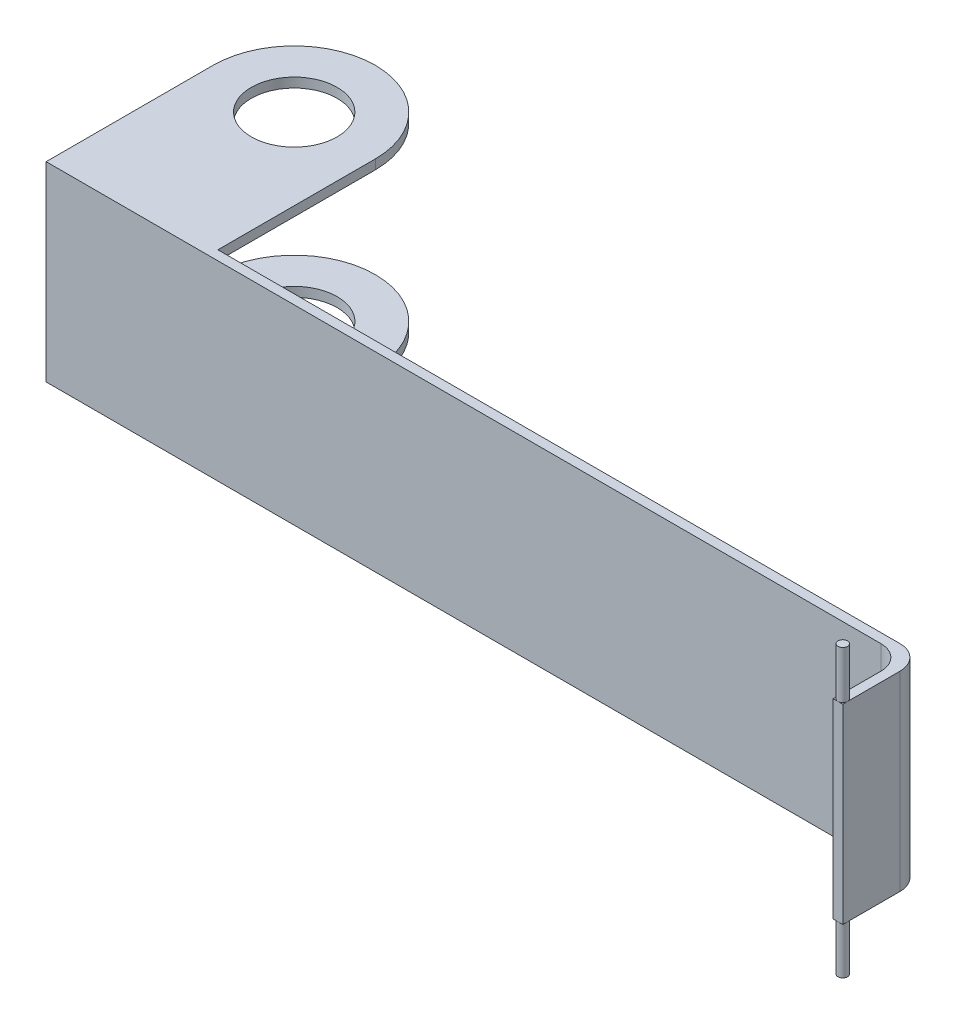
from build123d import *

# Parameters (mm, degrees)
SALIENTE_EXTRUIR1_DEPTH = 4
CROQUIS2_R              = 0.9
SALIENTE_EXTRUIR3_DEPTH = 0.2
SALIENTE_EXTRUIR4_START = -0.2
CROQUIS3_R              = 0.9
SALIENTE_EXTRUIR4_DEPTH = 0.2
CROQUIS4_R              = 0.1
SALIENTE_EXTRUIR5_DEPTH = 1
SALIENTE_EXTRUIR6_START = 1
CROQUIS5_R              = 0.1
SALIENTE_EXTRUIR6_DEPTH = 1


with BuildPart() as part:
    # Croquis1 → Saliente-Extruir1 (new body)
    with BuildSketch(Plane(origin=(0, 0, 0), x_dir=(1, 0, 0), z_dir=(0, 1, 0))):
        with BuildLine():
            Line((18.2, -0.3), (18.2, -1.5))
            Line((18.2, -1.5), (18, -1.5))
            Line((18, -1.5), (18, -0.5))
            ThreePointArc((18, -0.5), (17.853553391, -0.146446609), (17.5, 0))
            Line((17.5, 0), (0, 0))
            Line((0, 0), (0, 0.2))
            Line((0, 0.2), (17.7, 0.2))
            ThreePointArc((17.7, 0.2), (18.053553391, 0.053553391), (18.2, -0.3))
        make_face()
    extrude(amount=SALIENTE_EXTRUIR1_DEPTH)

    # Croquis2 → Saliente-Extruir3 (add)
    with BuildSketch(Plane(origin=(0, 4, 0), x_dir=(1, 0, 0), z_dir=(0, 1, 0))):
        with BuildLine():
            Line((0, 0.2), (3.4, 0.2))
            Line((3.4, 0.2), (3.4, 3.5))
            ThreePointArc((3.4, 3.5), (1.7, 5.2), (0, 3.5))
            Line((0, 3.5), (0, 0.2))
        make_face()
        with Locations(Location((1.7, 3.5, 0), (0, 0, 270))):
            Circle(CROQUIS2_R, mode=Mode.SUBTRACT)
    extrude(amount=-SALIENTE_EXTRUIR3_DEPTH)

    # Croquis3 → Saliente-Extruir4 (add)
    with BuildSketch(Plane(origin=(0, 0, 0), x_dir=(-1, 0, 0), z_dir=(0, -1, 0)).offset(SALIENTE_EXTRUIR4_START)):
        with BuildLine():
            Line((0, 0), (-3.4, 0))
            Line((-3.4, 0), (-3.4, 3.5))
            ThreePointArc((-3.4, 3.5), (-1.7, 5.2), (0, 3.5))
            Line((0, 3.5), (0, 0))
        make_face()
        with Locations(Location((-1.7, 3.5, 0), (0, 0, 270))):
            Circle(CROQUIS3_R, mode=Mode.SUBTRACT)
    extrude(amount=SALIENTE_EXTRUIR4_DEPTH)

    # Croquis4 → Saliente-Extruir5 (add)
    with BuildSketch(Plane(origin=(0, 4, 0), x_dir=(1, 0, 0), z_dir=(0, 1, 0))):
        with Locations(Location((18.1, -1.4, 0), (0, 0, 270))):
            Circle(CROQUIS4_R)
    extrude(amount=SALIENTE_EXTRUIR5_DEPTH)

    # Croquis5 → Saliente-Extruir6 (add)
    with BuildSketch(Plane(origin=(0, 0, 0), x_dir=(-1, 0, 0), z_dir=(0, -1, 0)).offset(SALIENTE_EXTRUIR6_START)):
        with Locations(Location((-18.1, -1.4, 0), (0, 0, 270))):
            Circle(CROQUIS5_R)
    extrude(amount=-SALIENTE_EXTRUIR6_DEPTH)


solid = part.part
